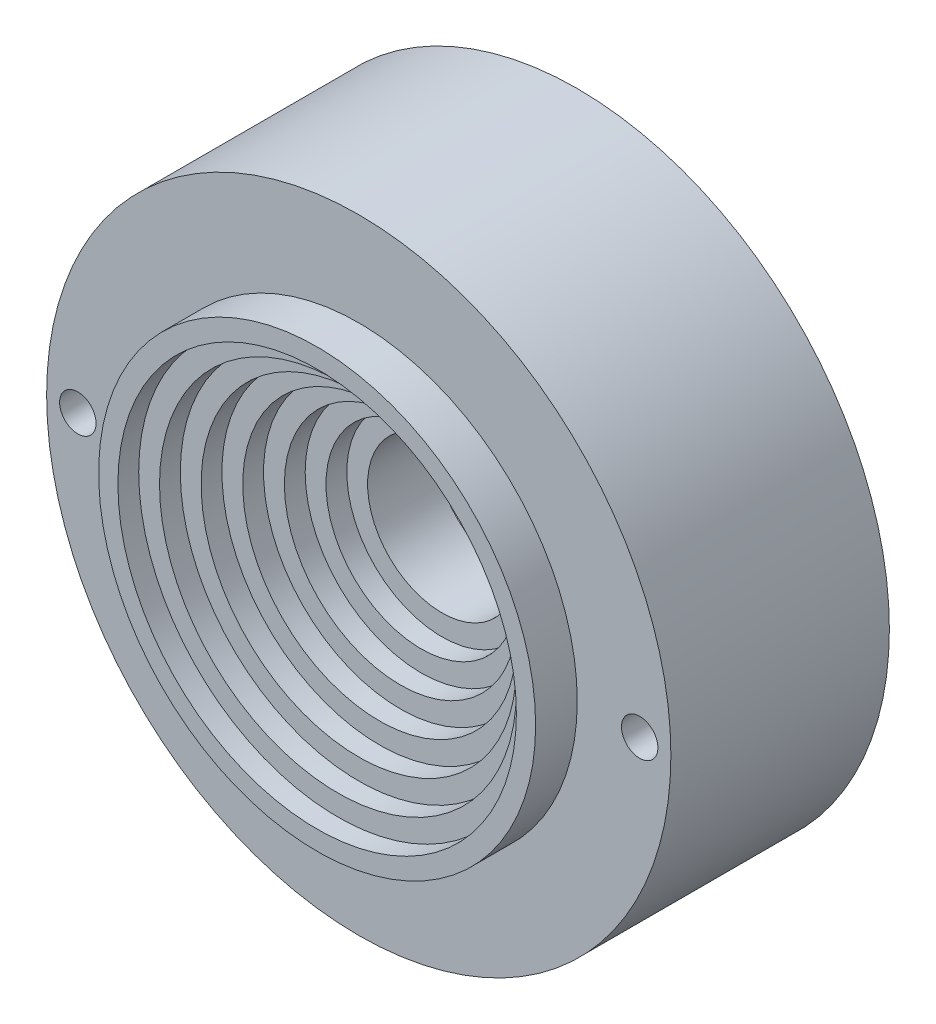
from build123d import *

# Parameters (mm, degrees)
BOSS_EXTRUDE1_START = 5
SKETCH2_R           = 30
SKETCH2_W           = 32
SKETCH2_H           = 32
BOSS_EXTRUDE1_DEPTH = 5
FILLET1_R           = 2
SKETCH3_2_R         = 1.75
CUT_EXTRUDE3_DEPTH  = 50.244289009
CUT_EXTRUDE4_DEPTH  = 1.5


with BuildPart() as part:
    # Sketch1 → Revolve1 (revolve)
    with BuildSketch(Plane(origin=(0, 0, 0), x_dir=(0, 0, -1), z_dir=(1, 0, 0))):
        Polygon((-16, 30), (0, 30), (0, 7.15), (-8, 7.15), (-8, 9.15), (-10, 9.15), (-10, 11.15), (-12, 11.15), (-12, 13.15), (-14, 13.15), (-14, 15.15), (-16, 15.15), (-16, 17.15), (-18, 17.15), (-18, 19.15), (-20, 19.15), (-20, 21), (-16, 21), align=None)
    revolve(axis=Axis((0, 0, 0), (0, 0, -1)))

    # Sketch2 → Boss-Extrude1 (add)
    with BuildSketch(Plane(origin=(0, 0, 0), x_dir=(-1, 0, 0), z_dir=(0, 0, -1)).offset(BOSS_EXTRUDE1_START)):
        Circle(SKETCH2_R)
        Rectangle(SKETCH2_W, SKETCH2_H, mode=Mode.SUBTRACT)
    extrude(amount=-BOSS_EXTRUDE1_DEPTH)

    # Fillet1
    fillet1_edges = [part.edges().sort_by_distance(p)[0] for p in [
        (16, -16, -2.5),
        (-16, -16, -2.5),
        (16, 16, -2.5),
        (-16, 16, -2.5),
    ]]
    fillet(fillet1_edges, radius=FILLET1_R)

    # Sketch3<2> → Cut-Extrude3 (cut, through all)
    with BuildSketch(Plane(origin=(0, 0, -5), x_dir=(-1, 0, 0), z_dir=(0, 0, -1))):
        with Locations((-27, 0)):
            Circle(SKETCH3_2_R)
        with Locations((27, 0)):
            Circle(SKETCH3_2_R)
    extrude(amount=-CUT_EXTRUDE3_DEPTH, mode=Mode.SUBTRACT)

    # Sketch4 → Cut-Extrude4 (cut)
    with BuildSketch(Plane(origin=(0, 0, 0), x_dir=(-1, 0, 0), z_dir=(0, 0, -1))):
        with BuildLine():
            Line((-12.15, -8.65), (12.15, -8.65))
            ThreePointArc((12.15, -8.65), (13.564213562, -8.064213562), (14.15, -6.65))
            Line((14.15, -6.65), (14.15, 6.65))
            ThreePointArc((14.15, 6.65), (13.564213562, 8.064213562), (12.15, 8.65))
            Line((12.15, 8.65), (-12.15, 8.65))
            ThreePointArc((-12.15, 8.65), (-13.564213562, 8.064213562), (-14.15, 6.65))
            Line((-14.15, 6.65), (-14.15, -6.65))
            ThreePointArc((-14.15, -6.65), (-13.564213562, -8.064213562), (-12.15, -8.65))
        make_face()
    extrude(amount=-CUT_EXTRUDE4_DEPTH, mode=Mode.SUBTRACT)


solid = part.part
